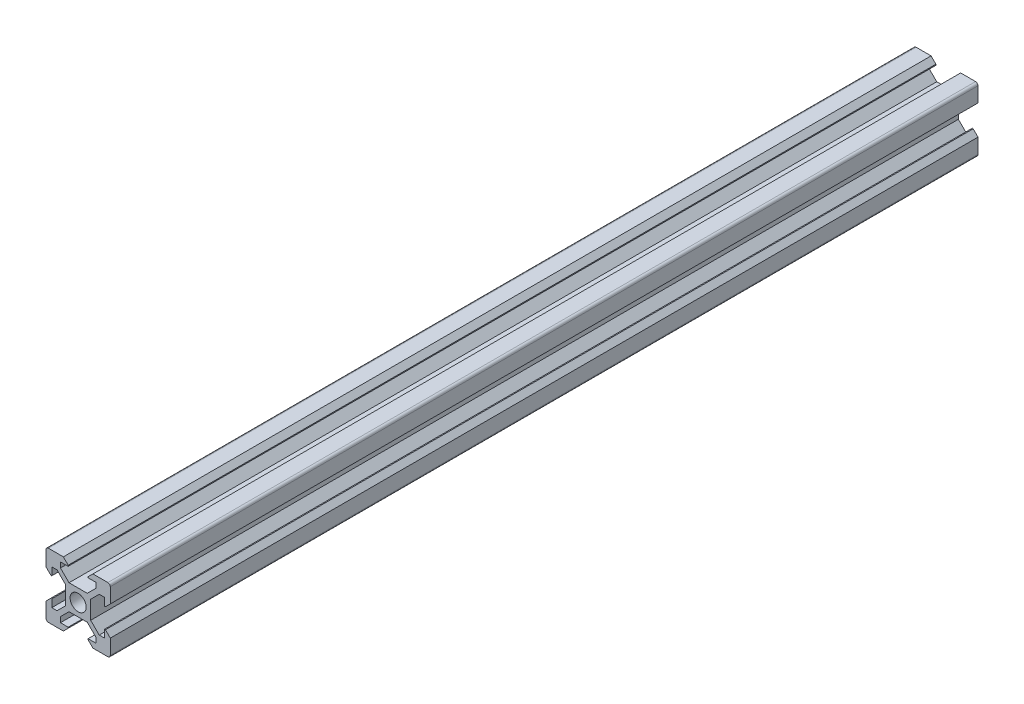
from build123d import *

# Parameters (mm, degrees)
CROQUIS1_R              = 2.5
SALIENTE_EXTRUIR1_DEPTH = 350
CUT_EXTRUDE1_DEPTH      = 47
CUT_EXTRUDE1_DEPTH_BACK = 40
SKETCH2_W               = 139.582587955
SKETCH2_H               = 242.432915921


with BuildPart() as part:
    # Croquis1 → Saliente-Extruir1 (new body)
    with BuildSketch(Plane.XY):
        with BuildLine():
            Line((-4.6, 10), (-3.1, 8.5))
            Line((-3.1, 8.5), (-3.1, 8.2))
            Line((-3.1, 8.2), (-5.5, 8.2))
            Line((-5.5, 8.2), (-5.5, 6.560660172))
            Line((-5.5, 6.560660172), (-2.84, 3.900660172))
            Line((-2.84, 3.900660172), (0, 3.900660172))
            Line((0, 3.900660172), (2.84, 3.900660172))
            Line((2.84, 3.900660172), (5.5, 6.560660172))
            Line((5.5, 6.560660172), (5.5, 8.2))
            Line((5.5, 8.2), (3.1, 8.2))
            Line((3.1, 8.2), (3.1, 8.5))
            Line((3.1, 8.5), (4.6, 10))
            Line((4.6, 10), (9.25, 10))
            ThreePointArc((9.25, 10), (9.780330086, 9.780330086), (10, 9.25))
            Line((10, 9.25), (10, 4.6))
            Line((10, 4.6), (8.5, 3.1))
            Line((8.5, 3.1), (8.2, 3.1))
            Line((8.2, 3.1), (8.2, 5.5))
            Line((8.2, 5.5), (6.560660172, 5.5))
            Line((6.560660172, 5.5), (3.900660172, 2.84))
            Line((3.900660172, 2.84), (3.900660172, 0))
            Line((3.900660172, 0), (3.900660172, -2.84))
            Line((3.900660172, -2.84), (6.560660172, -5.5))
            Line((6.560660172, -5.5), (8.2, -5.5))
            Line((8.2, -5.5), (8.2, -3.1))
            Line((8.2, -3.1), (8.5, -3.1))
            Line((8.5, -3.1), (10, -4.6))
            Line((10, -4.6), (10, -9.25))
            ThreePointArc((10, -9.25), (9.780330086, -9.780330086), (9.25, -10))
            Line((9.25, -10), (4.6, -10))
            Line((4.6, -10), (3.1, -8.5))
            Line((3.1, -8.5), (3.1, -8.2))
            Line((3.1, -8.2), (5.5, -8.2))
            Line((5.5, -8.2), (5.5, -6.560660172))
            Line((5.5, -6.560660172), (2.84, -3.900660172))
            Line((2.84, -3.900660172), (0, -3.900660172))
            Line((0, -3.900660172), (-2.84, -3.900660172))
            Line((-2.84, -3.900660172), (-5.5, -6.560660172))
            Line((-5.5, -6.560660172), (-5.5, -8.2))
            Line((-5.5, -8.2), (-3.1, -8.2))
            Line((-3.1, -8.2), (-3.1, -8.5))
            Line((-3.1, -8.5), (-4.6, -10))
            Line((-4.6, -10), (-9.25, -10))
            ThreePointArc((-9.25, -10), (-9.780330086, -9.780330086), (-10, -9.25))
            Line((-10, -9.25), (-10, -4.6))
            Line((-10, -4.6), (-8.5, -3.1))
            Line((-8.5, -3.1), (-8.2, -3.1))
            Line((-8.2, -3.1), (-8.2, -5.5))
            Line((-8.2, -5.5), (-6.560660172, -5.5))
            Line((-6.560660172, -5.5), (-3.900660172, -2.84))
            Line((-3.900660172, -2.84), (-3.900660172, 0))
            Line((-3.900660172, 0), (-3.900660172, 2.84))
            Line((-3.900660172, 2.84), (-6.560660172, 5.5))
            Line((-6.560660172, 5.5), (-8.2, 5.5))
            Line((-8.2, 5.5), (-8.2, 3.1))
            Line((-8.2, 3.1), (-8.5, 3.1))
            Line((-8.5, 3.1), (-10, 4.6))
            Line((-10, 4.6), (-10, 9.25))
            ThreePointArc((-10, 9.25), (-9.780330086, 9.780330086), (-9.25, 10))
            Line((-9.25, 10), (-4.6, 10))
        make_face()
        Circle(CROQUIS1_R, mode=Mode.SUBTRACT)
    extrude(amount=SALIENTE_EXTRUIR1_DEPTH)

    # Sketch2 → Cut-Extrude1 (cut, two sides: drawn at the far end of the back side and taken through both)
    with BuildSketch(Plane(origin=(0, 0, 0), x_dir=(1, 0, 0), z_dir=(0, 1, 0)).offset(-CUT_EXTRUDE1_DEPTH_BACK)):
        with Locations((12.355396541, -391.216457961)):
            Rectangle(SKETCH2_W, SKETCH2_H)
    extrude(amount=CUT_EXTRUDE1_DEPTH + CUT_EXTRUDE1_DEPTH_BACK, mode=Mode.SUBTRACT)


solid = part.part
